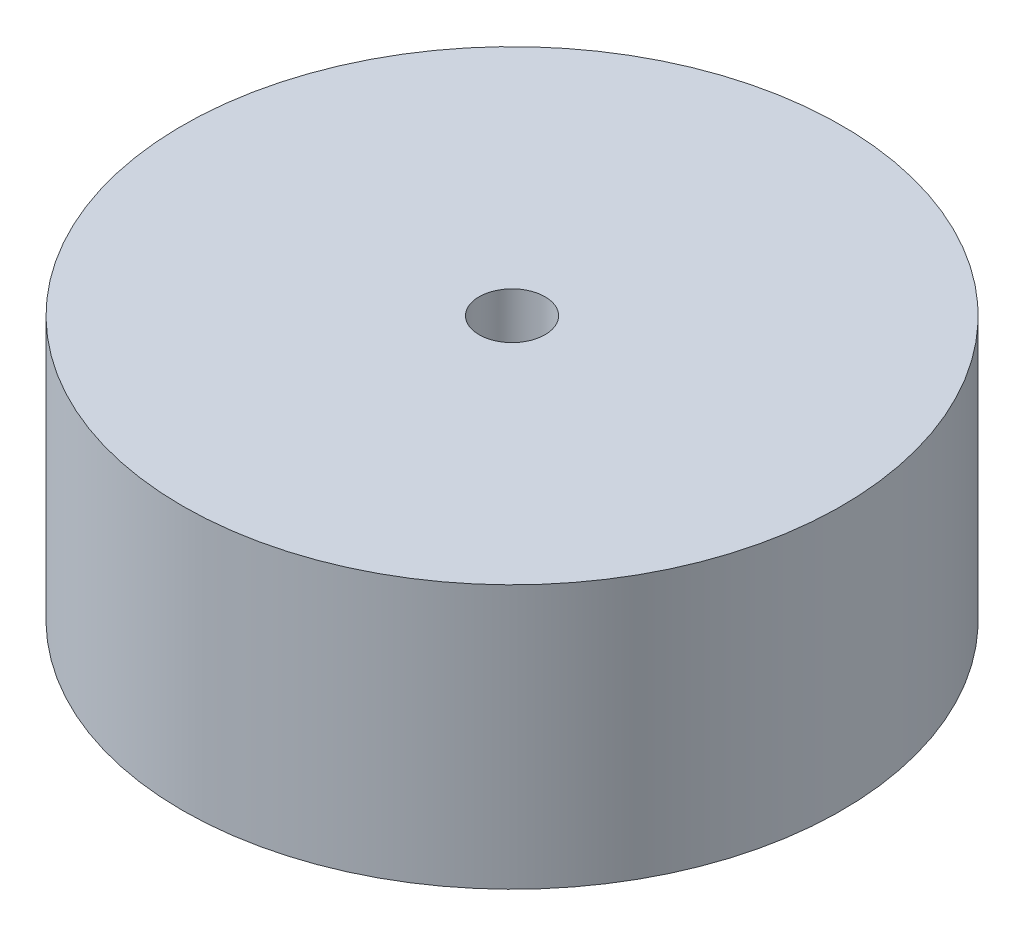
from build123d import *

# Parameters (mm, degrees)
SKETCH1_R           = 25
SKETCH1_R_2         = 2.5
BOSS_EXTRUDE1_DEPTH = 20
BOSS_EXTRUDE3_START = 14.5
BOSS_EXTRUDE3_DEPTH = 14.5
SKETCH7_R           = 15
BOSS_EXTRUDE4_DEPTH = 3
FILLET1_R           = 1


with BuildPart() as part:
    # Sketch1 → Boss-Extrude1 (new body)
    with BuildSketch(Plane(origin=(0, 0, 0), x_dir=(1, 0, 0), z_dir=(0, 1, 0))):
        with Locations(Location((0, 0, 0), (0, 0, 270))):
            Circle(SKETCH1_R)
        with Locations(Location((0, 0, 0), (0, 0, 270))):
            Circle(SKETCH1_R_2, mode=Mode.SUBTRACT)
    extrude(amount=BOSS_EXTRUDE1_DEPTH)

    # Sketch2 → Boss-Extrude3 (add)
    with BuildSketch(Plane.XZ.offset(BOSS_EXTRUDE3_START)):
        with BuildLine():
            ThreePointArc((-2, 3.464101615), (-4, 0), (-2, -3.464101615))
            ThreePointArc((-2, -3.464101615), (4, 0), (-2, 3.464101615))
        make_face()
        with BuildLine():
            ThreePointArc((-2, 1.5), (2.5, 0), (-2, -1.5))
            ThreePointArc((-2, -1.5), (-2.5, 0), (-2, 1.5))
        make_face(mode=Mode.SUBTRACT)
    extrude(amount=-BOSS_EXTRUDE3_DEPTH)

    # Sketch7 → Boss-Extrude4 (add)
    with BuildSketch(Plane.XZ):
        with Locations(Location((0, 0, 0), (0, 0, 90))):
            Circle(SKETCH7_R)
    extrude(amount=BOSS_EXTRUDE4_DEPTH)

    # Fillet1
    fillet1_edges = [part.edges().sort_by_distance(p)[0] for p in [
        (2, -3, -3.464101615),
    ]]
    fillet(fillet1_edges, radius=FILLET1_R)


solid = part.part
